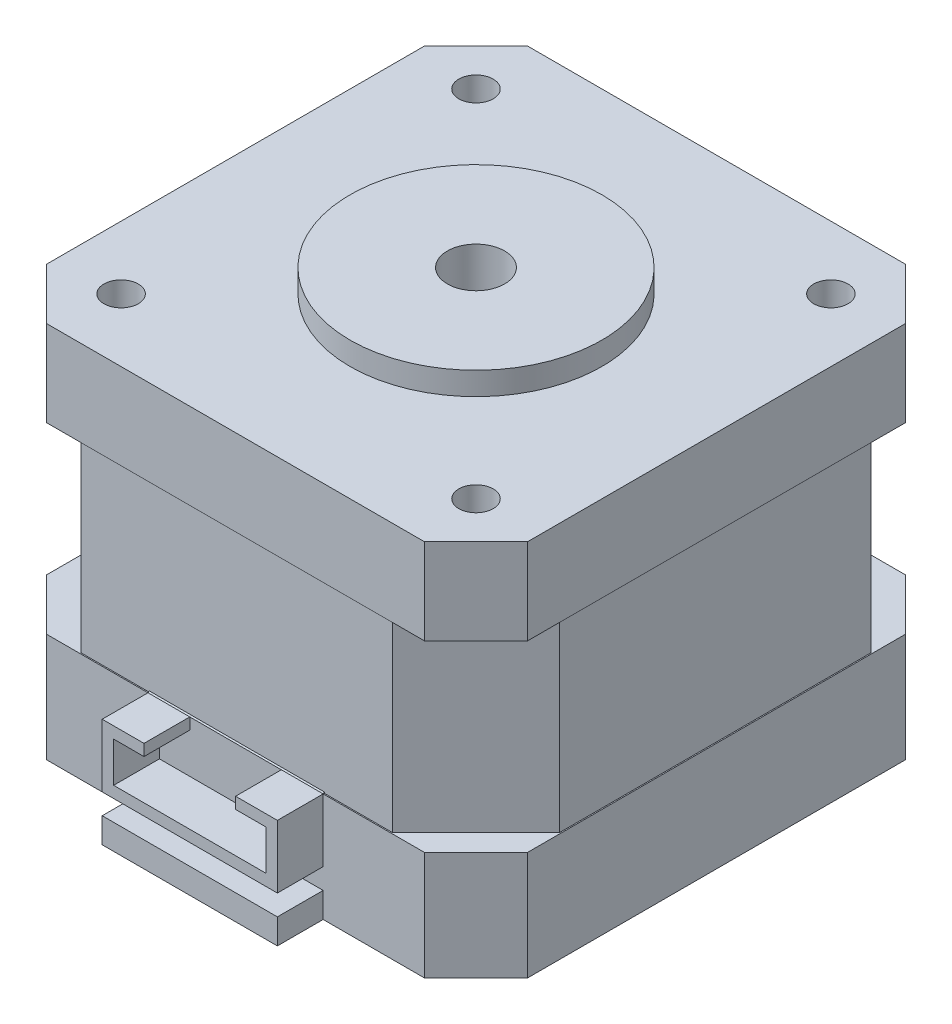
from build123d import *

# Parameters (mm, degrees)
SKETCH_1_W           = 42
SKETCH_1_H           = 42
EXTRUDE_1_DEPTH      = 33
CUT_EXTRUDE_START    = 33
CUT_EXTRUDE_1_DEPTH  = 33
CUT_EXTRUDE_START_2  = 9.5
CUT_EXTRUDE_2_DEPTH  = 16
CUT_EXTRUDE_START_3  = 21
SKETCH_4_W           = 33
SKETCH_4_H           = 16
CUT_EXTRUDE_3_DEPTH  = 0.1
CUT_EXTRUDE_START_4  = -21
SKETCH_5_W           = 33
SKETCH_5_H           = 16
CUT_EXTRUDE_4_DEPTH  = 0.1
SKETCH_6_W           = 33
SKETCH_6_H           = 16
CUT_EXTRUDE_5_DEPTH  = 0.1
SKETCH_7_W           = 33
SKETCH_7_H           = 16
CUT_EXTRUDE_6_DEPTH  = 0.1
SKETCH_8_R           = 4.75
CUT_EXTRUDE_7_DEPTH  = 3
EXTRUDE_START        = 33
SKETCH_9_R           = 11
EXTRUDE_2_DEPTH      = 2
CUT_EXTRUDE_START_5  = 35
SKETCH_11_R          = 2.5
CUT_EXTRUDE_8_DEPTH  = 35
SKETCH_12_R          = 1.5
CUT_EXTRUDE_9_DEPTH  = 33
EXTRUDE_START_2      = 21
SKETCH_13_W          = 15.3
SKETCH_13_H          = 2.2
EXTRUDE_3_DEPTH      = 4
SKETCH_17_W          = 15.3
SKETCH_17_H          = 5.5
EXTRUDE_7_DEPTH      = 4
CUT_EXTRUDE_START_6  = 25
CUT_EXTRUDE_11_DEPTH = 4
EXTRUDE_START_3      = 7.65
EXTRUDE_8_DEPTH      = 15.3


with BuildPart() as part:
    # 草图1 → 凸台-拉伸1 (new body)
    with BuildSketch(Plane(origin=(0, 0, 0), x_dir=(1, 0, 0), z_dir=(0, 1, 0))):
        Rectangle(SKETCH_1_W, SKETCH_1_H)
    extrude(amount=EXTRUDE_1_DEPTH)

    # 草图2 → 切除-拉伸1 (cut)
    with BuildSketch(Plane(origin=(0, 0, 0), x_dir=(1, 0, 0), z_dir=(0, 1, 0)).offset(CUT_EXTRUDE_START)):
        Polygon((-21, 21), (-21, 16.5), (-16.5, 21), align=None)
        Polygon((-21, -21), (-21, -16.5), (-16.5, -21), align=None)
        Polygon((21, -21), (21, -16.5), (16.5, -21), align=None)
        Polygon((21, 21), (21, 16.5), (16.5, 21), align=None)
    extrude(amount=-CUT_EXTRUDE_1_DEPTH, mode=Mode.SUBTRACT)

    # 草图3 → 切除-拉伸2 (cut)
    with BuildSketch(Plane(origin=(0, 0, 0), x_dir=(1, 0, 0), z_dir=(0, 1, 0)).offset(CUT_EXTRUDE_START_2)):
        Polygon((-21, 13.5), (-21, 21), (-13.5, 21), align=None)
        Polygon((-21, -13.5), (-21, -21), (-13.5, -21), align=None)
        Polygon((21, -13.5), (21, -21), (13.5, -21), align=None)
        Polygon((21, 13.5), (21, 21), (13.5, 21), align=None)
    extrude(amount=CUT_EXTRUDE_2_DEPTH, mode=Mode.SUBTRACT)

    # 草图4 → 切除-拉伸3 (cut)
    with BuildSketch(Plane.XY.offset(CUT_EXTRUDE_START_3)):
        with Locations((0, 17.5)):
            Rectangle(SKETCH_4_W, SKETCH_4_H)
    extrude(amount=-CUT_EXTRUDE_3_DEPTH, mode=Mode.SUBTRACT)

    # 草图5 → 切除-拉伸4 (cut)
    with BuildSketch(Plane.XY.offset(CUT_EXTRUDE_START_4)):
        with Locations((0, 17.5)):
            Rectangle(SKETCH_5_W, SKETCH_5_H)
    extrude(amount=CUT_EXTRUDE_4_DEPTH, mode=Mode.SUBTRACT)

    # 草图6 → 切除-拉伸5 (cut)
    with BuildSketch(Plane(origin=(0, 0, 0), x_dir=(0, 0, -1), z_dir=(1, 0, 0)).offset(CUT_EXTRUDE_START_4)):
        with Locations((0, 17.5)):
            Rectangle(SKETCH_6_W, SKETCH_6_H)
    extrude(amount=CUT_EXTRUDE_5_DEPTH, mode=Mode.SUBTRACT)

    # 草图7 → 切除-拉伸6 (cut)
    with BuildSketch(Plane(origin=(0, 0, 0), x_dir=(0, 0, -1), z_dir=(1, 0, 0)).offset(CUT_EXTRUDE_START_3)):
        with Locations((0, 17.5)):
            Rectangle(SKETCH_7_W, SKETCH_7_H)
    extrude(amount=-CUT_EXTRUDE_6_DEPTH, mode=Mode.SUBTRACT)

    # 草图8 → 切除-拉伸7 (cut)
    with BuildSketch(Plane(origin=(0, 0, 0), x_dir=(1, 0, 0), z_dir=(0, 1, 0))):
        with Locations(Location((0, 0, 0), (0, 0, 90))):
            Circle(SKETCH_8_R)
    extrude(amount=CUT_EXTRUDE_7_DEPTH, mode=Mode.SUBTRACT)

    # 草图9 → 凸台-拉伸2 (add)
    with BuildSketch(Plane(origin=(0, 0, 0), x_dir=(1, 0, 0), z_dir=(0, 1, 0)).offset(EXTRUDE_START)):
        with Locations(Location((0, 0, 0), (0, 0, 90))):
            Circle(SKETCH_9_R)
    extrude(amount=EXTRUDE_2_DEPTH)

    # 草图11 → 切除-拉伸8 (cut)
    with BuildSketch(Plane(origin=(0, 0, 0), x_dir=(1, 0, 0), z_dir=(0, 1, 0)).offset(CUT_EXTRUDE_START_5)):
        with Locations(Location((0, 0, 0), (0, 0, 90))):
            Circle(SKETCH_11_R)
    extrude(amount=-CUT_EXTRUDE_8_DEPTH, mode=Mode.SUBTRACT)

    # 草图12 → 切除-拉伸9 (cut)
    with BuildSketch(Plane(origin=(0, 0, 0), x_dir=(1, 0, 0), z_dir=(0, 1, 0)).offset(CUT_EXTRUDE_START)):
        with Locations(Location((-15.5, 15.5, 0), (0, 0, 90))):
            Circle(SKETCH_12_R)
        with Locations(Location((-15.5, -15.5, 0), (0, 0, 90))):
            Circle(SKETCH_12_R)
        with Locations(Location((15.5, -15.5, 0), (0, 0, 90))):
            Circle(SKETCH_12_R)
        with Locations(Location((15.5, 15.5, 0), (0, 0, 90))):
            Circle(SKETCH_12_R)
    extrude(amount=-CUT_EXTRUDE_9_DEPTH, mode=Mode.SUBTRACT)

    # 草图13 → 凸台-拉伸3 (add)
    with BuildSketch(Plane.XY.offset(EXTRUDE_START_2)):
        with Locations((0, 1.1)):
            Rectangle(SKETCH_13_W, SKETCH_13_H)
    extrude(amount=EXTRUDE_3_DEPTH)

    # 草图17 → 凸台-拉伸7 (add)
    with BuildSketch(Plane.XY.offset(EXTRUDE_START_2)):
        with Locations((0, 6.75)):
            Rectangle(SKETCH_17_W, SKETCH_17_H)
    extrude(amount=EXTRUDE_7_DEPTH)

    # 草图18 → 切除-拉伸11 (cut)
    with BuildSketch(Plane.XY.offset(CUT_EXTRUDE_START_6)):
        Polygon((-6.65, 8.5), (-4, 8.5), (-4, 9.5), (4, 9.5), (4, 8.5), (6.65, 8.5), (6.65, 5), (-6.65, 5), align=None)
    extrude(amount=-CUT_EXTRUDE_11_DEPTH, mode=Mode.SUBTRACT)

    # 草图19 → 凸台-拉伸8 (add)
    with BuildSketch(Plane(origin=(0, 0, 0), x_dir=(0, 0, -1), z_dir=(1, 0, 0)).offset(EXTRUDE_START_3)):
        Polygon((-21, 9.5), (-20.9, 9.5), (-20.9, 9.6), align=None)
    extrude(amount=-EXTRUDE_8_DEPTH)


solid = part.part
